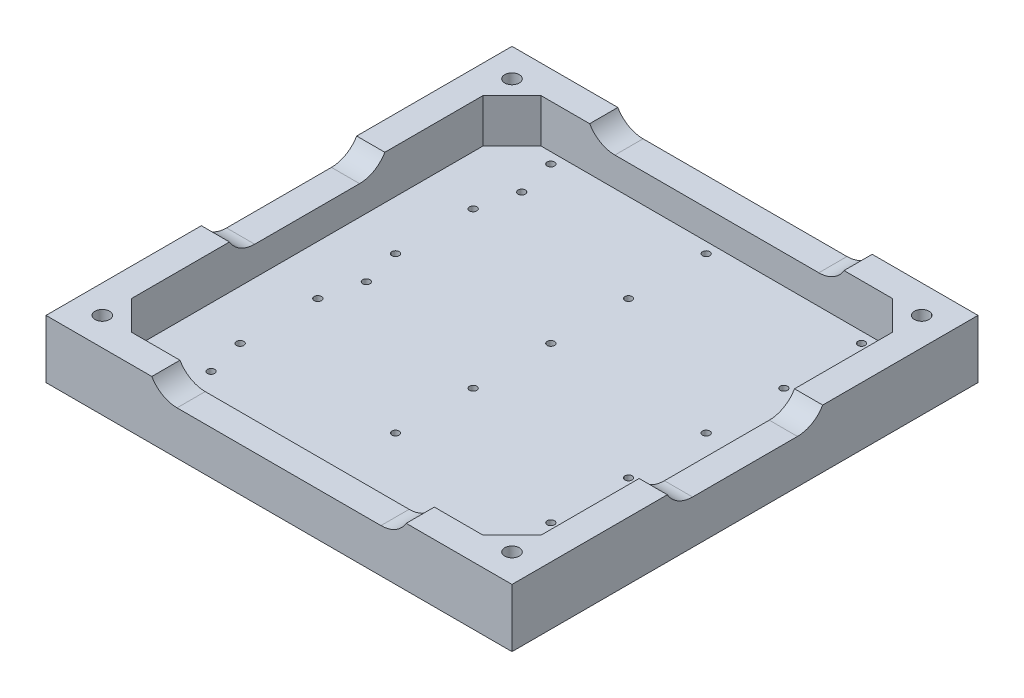
from build123d import *

# Parameters (mm, degrees)
SKETCH1_W           = 96
SKETCH1_H           = 96
SKETCH1_R           = 0.75
BOSS_EXTRUDE1_DEPTH = 3
SKETCH2_W           = 96
SKETCH2_H           = 96
BOSS_EXTRUDE2_DEPTH = 9
SKETCH3_R           = 1.5
CUT_EXTRUDE1_DEPTH  = 9
CUT_EXTRUDE2_DEPTH  = 109
CUT_EXTRUDE3_DEPTH  = 131.782261794
SKETCH6_R           = 0.75
CUT_EXTRUDE4_DEPTH  = 101.642933185
LPATTERN4_COUNT     = 3
LPATTERN4_PITCH     = 32


with BuildPart() as part:
    # Sketch1 → Boss-Extrude1 (new body)
    with BuildSketch(Plane(origin=(0, 0, 0), x_dir=(1, 0, 0), z_dir=(0, 1, 0))):
        with Locations((0, -40)):
            Rectangle(SKETCH1_W, SKETCH1_H)
        with Locations(Location((0, 0, 0), (0, 0, 270))):
            Circle(SKETCH1_R, mode=Mode.SUBTRACT)
        with Locations(Location((32, 0, 0), (0, 0, 270))):
            Circle(SKETCH1_R, mode=Mode.SUBTRACT)
        with Locations(Location((-32, 0, 0), (0, 0, 270))):
            Circle(SKETCH1_R, mode=Mode.SUBTRACT)
        with Locations(Location((0, -16, 0), (0, 0, 270))):
            Circle(SKETCH1_R, mode=Mode.SUBTRACT)
        with Locations(Location((-32, -16, 0), (0, 0, 270))):
            Circle(SKETCH1_R, mode=Mode.SUBTRACT)
        with Locations(Location((32, -16, 0), (0, 0, 270))):
            Circle(SKETCH1_R, mode=Mode.SUBTRACT)
        with Locations(Location((0, -32, 0), (0, 0, 270))):
            Circle(SKETCH1_R, mode=Mode.SUBTRACT)
        with Locations(Location((-32, -32, 0), (0, 0, 270))):
            Circle(SKETCH1_R, mode=Mode.SUBTRACT)
        with Locations(Location((32, -32, 0), (0, 0, 270))):
            Circle(SKETCH1_R, mode=Mode.SUBTRACT)
        with Locations(Location((0, -48, 0), (0, 0, 270))):
            Circle(SKETCH1_R, mode=Mode.SUBTRACT)
        with Locations(Location((-32, -48, 0), (0, 0, 270))):
            Circle(SKETCH1_R, mode=Mode.SUBTRACT)
        with Locations(Location((32, -48, 0), (0, 0, 270))):
            Circle(SKETCH1_R, mode=Mode.SUBTRACT)
        with Locations(Location((0, -64, 0), (0, 0, 270))):
            Circle(SKETCH1_R, mode=Mode.SUBTRACT)
        with Locations(Location((-32, -64, 0), (0, 0, 270))):
            Circle(SKETCH1_R, mode=Mode.SUBTRACT)
        with Locations(Location((32, -64, 0), (0, 0, 270))):
            Circle(SKETCH1_R, mode=Mode.SUBTRACT)
        with Locations(Location((0, -80, 0), (0, 0, 270))):
            Circle(SKETCH1_R, mode=Mode.SUBTRACT)
        with Locations(Location((-32, -80, 0), (0, 0, 270))):
            Circle(SKETCH1_R, mode=Mode.SUBTRACT)
        with Locations(Location((32, -80, 0), (0, 0, 270))):
            Circle(SKETCH1_R, mode=Mode.SUBTRACT)
    extrude(amount=BOSS_EXTRUDE1_DEPTH)

    # Sketch2 → Boss-Extrude2 (add)
    with BuildSketch(Plane(origin=(0, 3, 0), x_dir=(1, 0, 0), z_dir=(0, 1, 0))):
        with Locations((0, -40)):
            Rectangle(SKETCH2_W, SKETCH2_H)
        Polygon((-36.2, 2.2), (36.2, 2.2), (42.2, -3.8), (42.2, -76.2), (36.2, -82.2), (-36.2, -82.2), (-42.2, -76.2), (-42.2, -3.8), align=None, mode=Mode.SUBTRACT)
    extrude(amount=BOSS_EXTRUDE2_DEPTH)

    # Sketch3 → Cut-Extrude1 (cut)
    with BuildSketch(Plane(origin=(0, 12, 0), x_dir=(1, 0, 0), z_dir=(0, 1, 0))):
        with Locations(Location((-42.2, 2.2, 0), (0, 0, 270))):
            Circle(SKETCH3_R)
        with Locations(Location((42.2, 2.2, 0), (0, 0, 270))):
            Circle(SKETCH3_R)
        with Locations(Location((42.2, -82.2, 0), (0, 0, 270))):
            Circle(SKETCH3_R)
        with Locations(Location((-42.2, -82.2, 0), (0, 0, 270))):
            Circle(SKETCH3_R)
    extrude(amount=-CUT_EXTRUDE1_DEPTH, mode=Mode.SUBTRACT)

    # Sketch4 → Cut-Extrude2 (cut, through all)
    with BuildSketch(Plane.XY.offset(88)):
        with BuildLine():
            Line((-26.2, 12), (26.2, 12))
            ThreePointArc((26.2, 12), (24.003847577, 9.803847577), (21.003847577, 9))
            Line((21.003847577, 9), (-21.003847577, 9))
            ThreePointArc((-21.003847577, 9), (-24.003847577, 9.803847577), (-26.2, 12))
        make_face()
    extrude(amount=-CUT_EXTRUDE2_DEPTH, mode=Mode.SUBTRACT)

    # Sketch5 → Cut-Extrude3 (cut, through all)
    with BuildSketch(Plane.ZY.offset(48)):
        with BuildLine():
            Line((29.196152423, 9), (50.803847577, 9))
            ThreePointArc((50.803847577, 9), (53.803847577, 9.803847577), (56, 12))
            Line((56, 12), (24, 12))
            ThreePointArc((24, 12), (26.196152423, 9.803847577), (29.196152423, 9))
        make_face()
    extrude(amount=-CUT_EXTRUDE3_DEPTH, mode=Mode.SUBTRACT)

    # Sketch6 → Cut-Extrude4 (cut, through all)
    with BuildSketch(Plane(origin=(0, 3, 0), x_dir=(1, 0, 0), z_dir=(0, 1, 0))):
        with Locations(Location((-30, -72, 0), (0, 0, 270))):
            Circle(SKETCH6_R)
    cut_extrude4 = extrude(amount=-CUT_EXTRUDE4_DEPTH, mode=Mode.SUBTRACT)

    # LPattern4: Cut-Extrude4 ×3
    with Locations(*[(0, 0, -i * LPATTERN4_PITCH) for i in range(1, LPATTERN4_COUNT)]):
        add(cut_extrude4, mode=Mode.SUBTRACT)


solid = part.part
